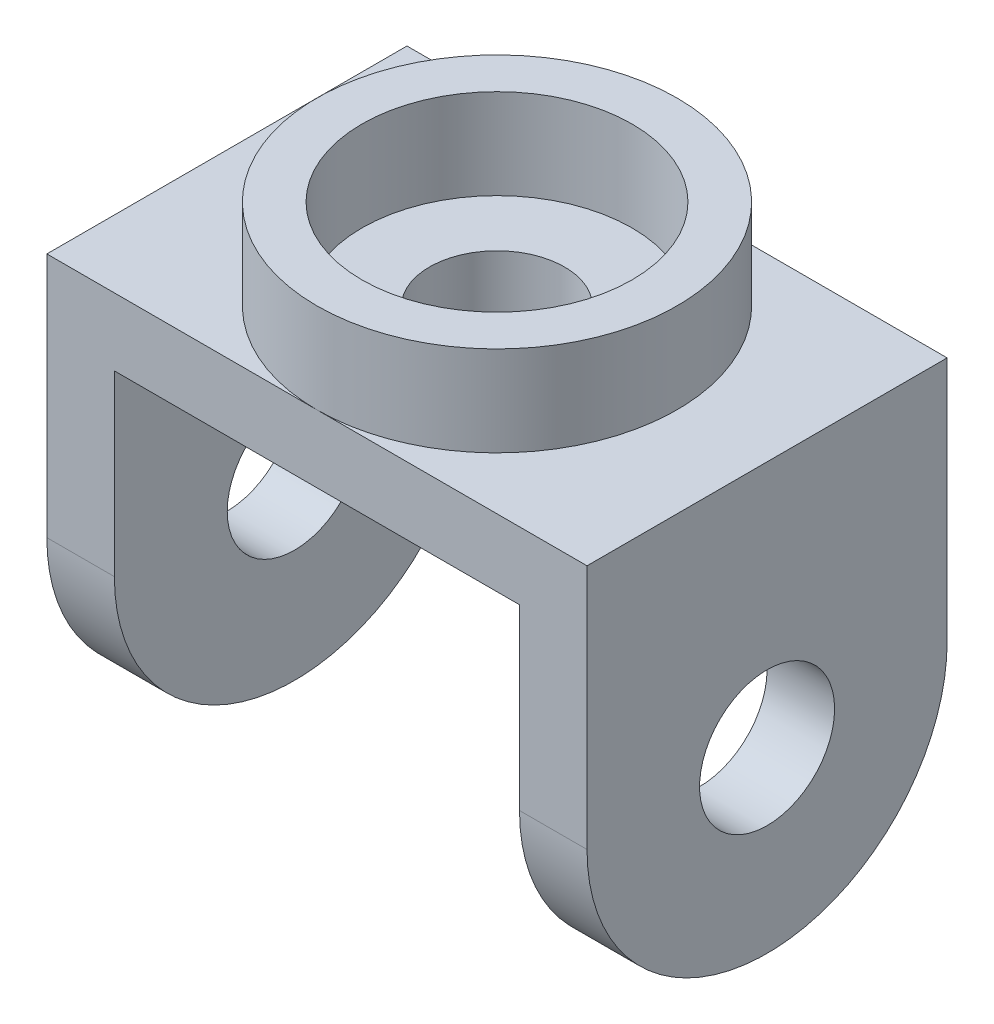
from build123d import *

# Parameters (mm, degrees)
SKETCH2_W           = 30.48
SKETCH2_H           = 20.32
BOSS_EXTRUDE1_DEPTH = 3.81
SKETCH3_R           = 10.16
SKETCH3_R_2         = 7.62
BOSS_EXTRUDE2_DEPTH = 5.08
SKETCH4_R           = 3.81
CUT_EXTRUDE1_DEPTH  = 20.007619525
BOSS_EXTRUDE3_DEPTH = 3.81
SKETCH11_R          = 3.81
CUT_EXTRUDE3_DEPTH  = 3.81
BOSS_EXTRUDE5_START = -3.81
SKETCH12_R          = 3.791845508
BOSS_EXTRUDE5_DEPTH = 3.81


with BuildPart() as part:
    # Sketch2 → Boss-Extrude1 (new body)
    with BuildSketch(Plane(origin=(0, 0, 0), x_dir=(1, 0, 0), z_dir=(0, 1, 0))):
        Rectangle(SKETCH2_W, SKETCH2_H)
    extrude(amount=BOSS_EXTRUDE1_DEPTH)

    # Sketch3 → Boss-Extrude2 (add)
    with BuildSketch(Plane(origin=(0, 3.81, 0), x_dir=(1, 0, 0), z_dir=(0, 1, 0))):
        with Locations(Location((0, 0, 0), (0, 0, 270))):
            Circle(SKETCH3_R)
        with Locations(Location((0, 0, 0), (0, 0, 270))):
            Circle(SKETCH3_R_2, mode=Mode.SUBTRACT)
    extrude(amount=BOSS_EXTRUDE2_DEPTH)

    # Sketch4 → Cut-Extrude1 (cut, through all)
    with BuildSketch(Plane(origin=(0, 3.81, 0), x_dir=(1, 0, 0), z_dir=(0, 1, 0))):
        with Locations(Location((0, 0, 0), (0, 0, 270))):
            Circle(SKETCH4_R)
    extrude(amount=-CUT_EXTRUDE1_DEPTH, mode=Mode.SUBTRACT)

    # Sketch6 → Boss-Extrude3 (add)
    with BuildSketch(Plane(origin=(15.24, 0, 0), x_dir=(0, 0, -1), z_dir=(1, 0, 0))):
        with BuildLine():
            Line((-10.16, 3.81), (-10.16, -10.054809762))
            ThreePointArc((-10.16, -10.054809762), (0, -20.214809762), (10.16, -10.054809762))
            Line((10.16, -10.054809762), (10.16, 3.81))
            Line((10.16, 3.81), (-10.16, 3.81))
        make_face()
    extrude(amount=-BOSS_EXTRUDE3_DEPTH)

    # Sketch11 → Cut-Extrude3 (cut)
    with BuildSketch(Plane(origin=(15.24, 0, 0), x_dir=(0, 0, -1), z_dir=(1, 0, 0))):
        with Locations((0, -10.16)):
            Circle(SKETCH11_R)
    extrude(amount=-CUT_EXTRUDE3_DEPTH, mode=Mode.SUBTRACT)

    # Sketch12 → Boss-Extrude5 (add)
    with BuildSketch(Plane.ZY.offset(15.24).offset(BOSS_EXTRUDE5_START)):
        with BuildLine():
            Line((-10.16, 3.81), (-10.16, -10.054809762))
            ThreePointArc((-10.16, -10.054809762), (0, -20.214809762), (10.16, -10.054809762))
            Line((10.16, -10.054809762), (10.16, 3.81))
            Line((10.16, 3.81), (-10.16, 3.81))
        make_face()
        with Locations((0, -10.054809762)):
            Circle(SKETCH12_R, mode=Mode.SUBTRACT)
    extrude(amount=BOSS_EXTRUDE5_DEPTH)


solid = part.part
